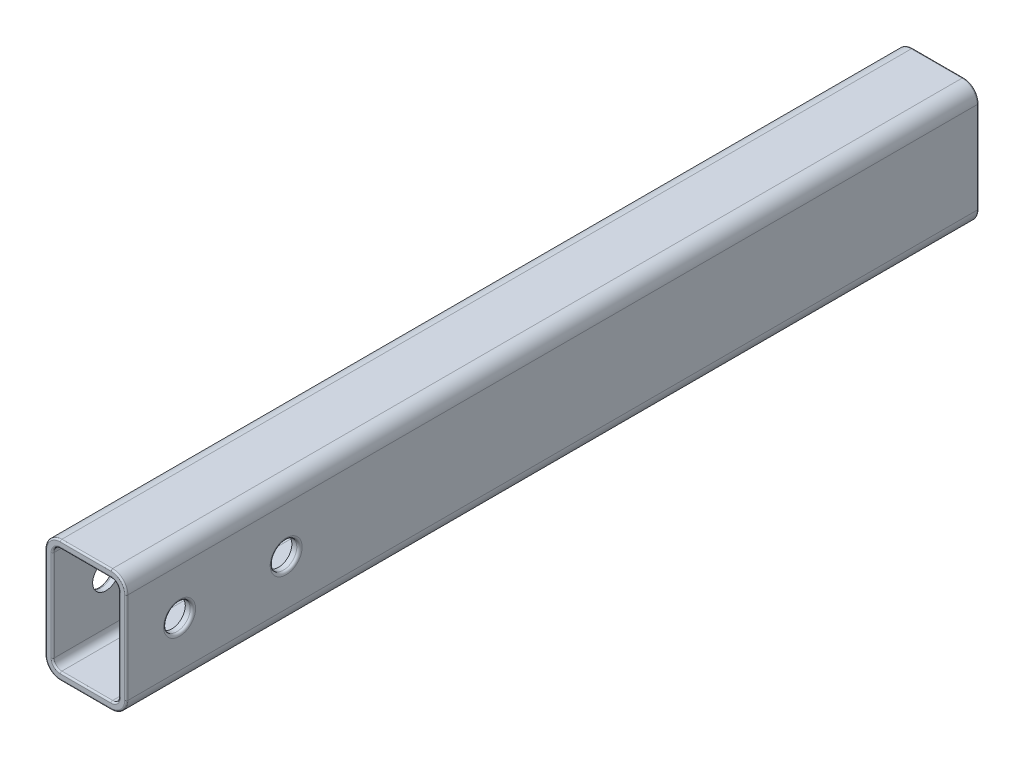
from build123d import *

# Parameters (mm, degrees)
TUBE_RECTANGULAR_TR9X6X0_5625_1_DEPTH = 1600
SKETCH130_R                           = 25
CUT_EXTRUDE1_DEPTH                    = 1115.775430818
FILLET2_R                             = 5
FILLET3_R                             = 3


with BuildPart() as part:
    # Sketch129 → Tube rectangular TR9X6X0.5625(1) (new body)
    with BuildSketch(Plane.XY.offset(-1098.377899976)):
        with BuildLine():
            Line((-47.625, -114.3), (47.625, -114.3))
            ThreePointArc((47.625, -114.3), (67.830576272, -105.930576272), (76.2, -85.725))
            Line((76.2, -85.725), (76.2, 85.725))
            ThreePointArc((76.2, 85.725), (67.830576272, 105.930576272), (47.625, 114.3))
            Line((47.625, 114.3), (-47.625, 114.3))
            ThreePointArc((-47.625, 114.3), (-67.830576272, 105.930576272), (-76.2, 85.725))
            Line((-76.2, 85.725), (-76.2, -85.725))
            ThreePointArc((-76.2, -85.725), (-67.830576272, -105.930576272), (-47.625, -114.3))
        make_face()
        with BuildLine():
            Line((-47.625, -100.0125), (47.625, -100.0125))
            ThreePointArc((47.625, -100.0125), (57.727788136, -95.827788136), (61.9125, -85.725))
            Line((61.9125, -85.725), (61.9125, 85.725))
            ThreePointArc((61.9125, 85.725), (57.727788136, 95.827788136), (47.625, 100.0125))
            Line((47.625, 100.0125), (-47.625, 100.0125))
            ThreePointArc((-47.625, 100.0125), (-57.727788136, 95.827788136), (-61.9125, 85.725))
            Line((-61.9125, 85.725), (-61.9125, -85.725))
            ThreePointArc((-61.9125, -85.725), (-57.727788136, -95.827788136), (-47.625, -100.0125))
        make_face(mode=Mode.SUBTRACT)
    extrude(amount=TUBE_RECTANGULAR_TR9X6X0_5625_1_DEPTH)

    # Sketch130 → Cut-Extrude1 (cut, through all)
    with BuildSketch(Plane(origin=(76.2, 0, 0), x_dir=(0, 0, -1), z_dir=(1, 0, 0))):
        with Locations((-401.622100024, 0)):
            Circle(SKETCH130_R)
        with Locations((-201.622100024, 0)):
            Circle(SKETCH130_R)
    extrude(amount=-CUT_EXTRUDE1_DEPTH, mode=Mode.SUBTRACT)

    # Fillet2
    fillet2_edges = [part.edges().sort_by_distance(p)[0] for p in [
        (-76.2, 0, 426.622100024),
        (76.2, 0, 426.622100024),
        (-76.2, 0, 226.622100024),
        (76.2, 0, 226.622100024),
    ]]
    fillet(fillet2_edges, radius=FILLET2_R)

    # Fillet3
    fillet3_edges = [part.edges().sort_by_distance(p)[0] for p in [
        (0, 100.0125, 501.622100024),
        (57.727788136, 95.827788136, 501.622100024),
        (76.2, 0, -1098.377899976),
        (67.830576272, -105.930576272, -1098.377899976),
        (0, -114.3, -1098.377899976),
        (-67.830576272, -105.930576272, -1098.377899976),
        (-76.2, 0, -1098.377899976),
        (61.9125, 0, 501.622100024),
        (-67.830576272, 105.930576272, -1098.377899976),
        (0, 114.3, -1098.377899976),
        (67.830576272, 105.930576272, -1098.377899976),
        (-61.9125, 0, -1098.377899976),
        (-57.727788136, -95.827788136, -1098.377899976),
        (0, -100.0125, -1098.377899976),
        (57.727788136, -95.827788136, -1098.377899976),
        (61.9125, 0, -1098.377899976),
        (57.727788136, 95.827788136, -1098.377899976),
        (0, 100.0125, -1098.377899976),
        (57.727788136, -95.827788136, 501.622100024),
        (-57.727788136, 95.827788136, -1098.377899976),
        (0, -100.0125, 501.622100024),
        (-57.727788136, -95.827788136, 501.622100024),
        (-61.9125, 0, 501.622100024),
        (67.830576272, 105.930576272, 501.622100024),
        (0, 114.3, 501.622100024),
        (-67.830576272, 105.930576272, 501.622100024),
        (-76.2, 0, 501.622100024),
        (-67.830576272, -105.930576272, 501.622100024),
        (0, -114.3, 501.622100024),
        (-57.727788136, 95.827788136, 501.622100024),
        (67.830576272, -105.930576272, 501.622100024),
        (76.2, 0, 501.622100024),
    ]]
    fillet(fillet3_edges, radius=FILLET3_R)


solid = part.part
